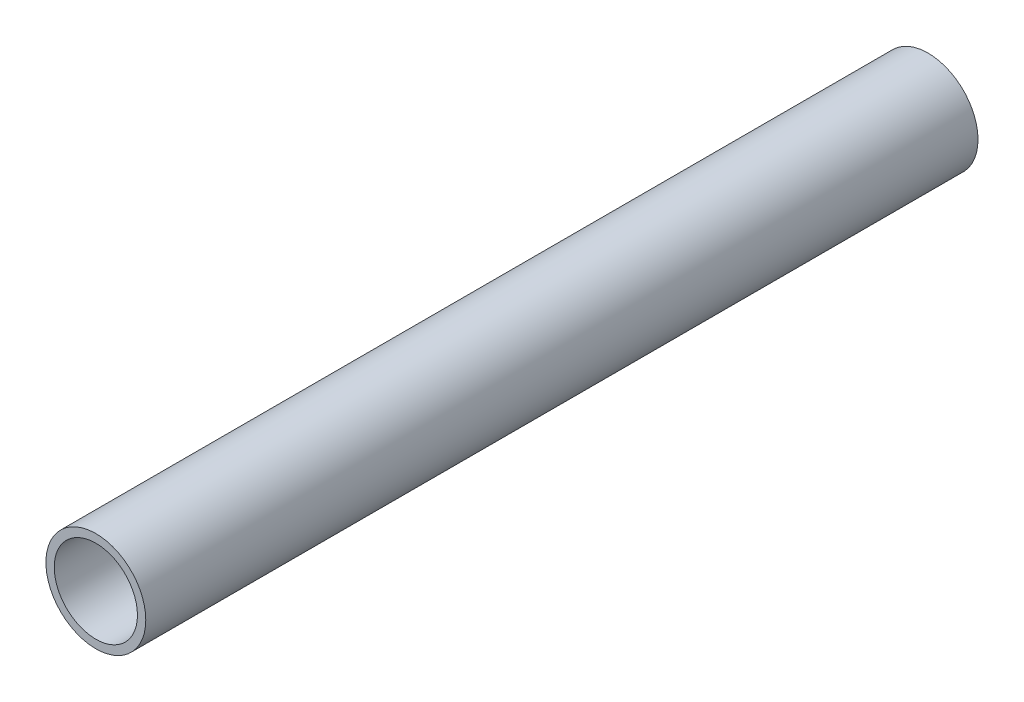
from build123d import *

# Parameters (mm, degrees)
SKETCH_1_R      = 6
SKETCH_1_R_2    = 5
EXTRUDE_1_DEPTH = 100


with BuildPart() as part:
    # 草图1 → 凸台-拉伸1 (new body)
    with BuildSketch(Plane.XY):
        Circle(SKETCH_1_R)
        Circle(SKETCH_1_R_2, mode=Mode.SUBTRACT)
    extrude(amount=EXTRUDE_1_DEPTH)


solid = part.part
